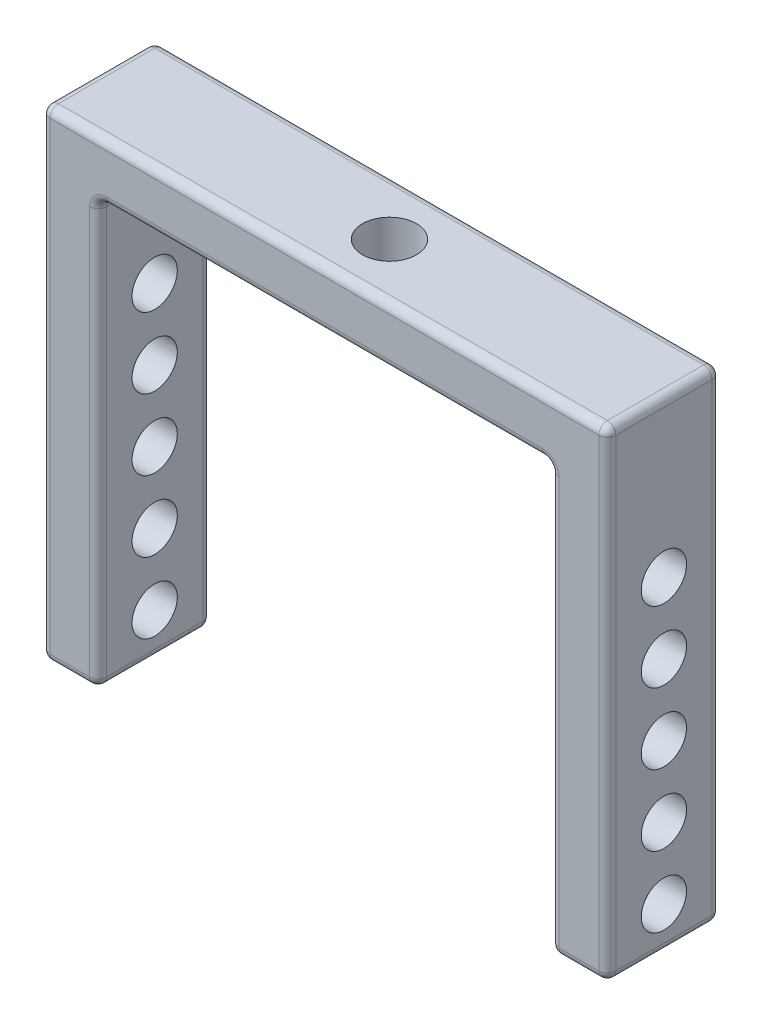
from build123d import *

# Parameters (mm, degrees)
BOSS_EXTRUDE1_DEPTH = 40
FILLET1_R           = 3
SKETCH2_R           = 9.55
CUT_EXTRUDE1_DEPTH  = 20
SKETCH5_R           = 8
CUT_EXTRUDE2_DEPTH  = 200
LPATTERN2_COUNT     = 5
LPATTERN2_PITCH     = 25


with BuildPart() as part:
    # Sketch1 → Boss-Extrude1 (new body)
    with BuildSketch(Plane.XY):
        Polygon((107.5, 210), (107.5, 60), (127.5, 60), (127.5, 210), (287.5, 210), (287.5, 60), (307.5, 60), (307.5, 210), (307.5, 230), (107.5, 230), align=None)
    extrude(amount=BOSS_EXTRUDE1_DEPTH)

    # Fillet1
    fillet1_edges = [part.edges().sort_by_distance(p)[0] for p in [
        (307.5, 145, 0),
        (297.5, 60, 0),
        (287.5, 135, 0),
        (207.5, 210, 0),
        (127.5, 135, 0),
        (117.5, 60, 0),
        (107.5, 145, 0),
        (207.5, 230, 0),
        (117.5, 60, 40),
        (307.5, 230, 20),
        (307.5, 60, 20),
        (287.5, 60, 20),
        (287.5, 210, 20),
        (127.5, 210, 20),
        (127.5, 60, 20),
        (107.5, 60, 20),
        (107.5, 230, 20),
        (127.5, 135, 40),
        (207.5, 210, 40),
        (287.5, 135, 40),
        (297.5, 60, 40),
        (307.5, 145, 40),
        (207.5, 230, 40),
        (107.5, 145, 40),
    ]]
    fillet(fillet1_edges, radius=FILLET1_R)

    # Sketch2 → Cut-Extrude1 (cut)
    with BuildSketch(Plane(origin=(0, 230, 0), x_dir=(1, 0, 0), z_dir=(0, 1, 0))):
        with Locations(Location((210.5, -20, 0), (0, 0, 270))):
            Circle(SKETCH2_R)
    extrude(amount=-CUT_EXTRUDE1_DEPTH, mode=Mode.SUBTRACT)

    # Sketch5 → Cut-Extrude2 (cut)
    with BuildSketch(Plane.ZY.offset(-107.5)):
        with Locations(Location((20, 75, 0), (0, 0, 270))):
            Circle(SKETCH5_R)
    cut_extrude2 = extrude(amount=-CUT_EXTRUDE2_DEPTH, mode=Mode.SUBTRACT)

    # LPattern2: Cut-Extrude2 ×5
    with Locations(*[(0, i * LPATTERN2_PITCH, 0) for i in range(1, LPATTERN2_COUNT)]):
        add(cut_extrude2, mode=Mode.SUBTRACT)


solid = part.part
